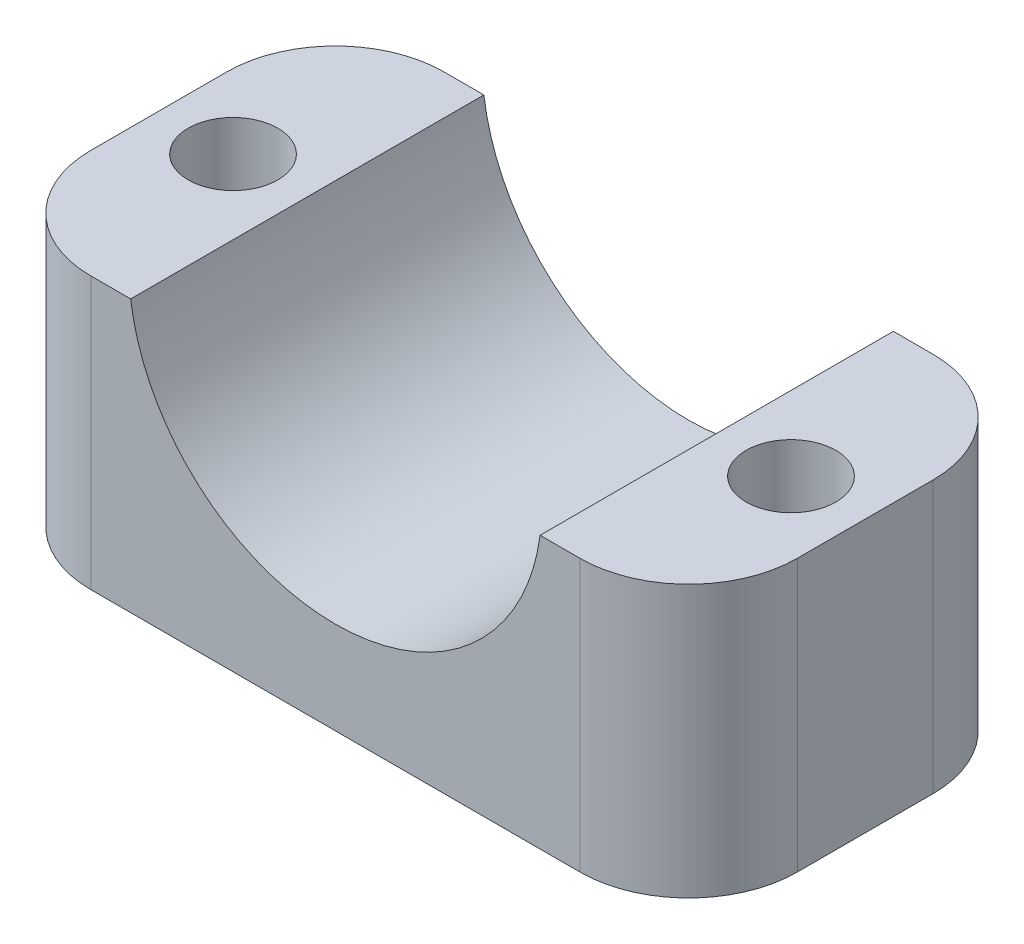
from build123d import *

# Parameters (mm, degrees)
SKETCH1_W           = 26
SKETCH1_H           = 10
BOSS_EXTRUDE1_DEPTH = 13
SKETCH2_R           = 7.6
CUT_EXTRUDE1_DEPTH  = 20.052558883
SKETCH3_R           = 1.65
CUT_EXTRUDE2_DEPTH  = 10
FILLET2_R           = 4


with BuildPart() as part:
    # Sketch1 → Boss-Extrude1 (new body)
    with BuildSketch(Plane.XY):
        Rectangle(SKETCH1_W, SKETCH1_H)
    extrude(amount=BOSS_EXTRUDE1_DEPTH)

    # Sketch2 → Cut-Extrude1 (cut, through all)
    with BuildSketch(Plane.XY.offset(13)):
        with Locations((0, 6)):
            Circle(SKETCH2_R)
    extrude(amount=-CUT_EXTRUDE1_DEPTH, mode=Mode.SUBTRACT)

    # Sketch3 → Cut-Extrude2 (cut)
    with BuildSketch(Plane(origin=(0, 5, 0), x_dir=(1, 0, 0), z_dir=(0, 1, 0))):
        with Locations(Location((-10.26696164, -6.5, 0), (0, 0, 270))):
            Circle(SKETCH3_R)
        with Locations(Location((10.26696164, -6.5, 0), (0, 0, 270))):
            Circle(SKETCH3_R)
    extrude(amount=-CUT_EXTRUDE2_DEPTH, mode=Mode.SUBTRACT)

    # Fillet2
    fillet2_edges = [part.edges().sort_by_distance(p)[0] for p in [
        (-13, 0, 13),
        (13, 0, 13),
        (-13, 0, 0),
        (13, 0, 0),
    ]]
    fillet(fillet2_edges, radius=FILLET2_R)


solid = part.part
